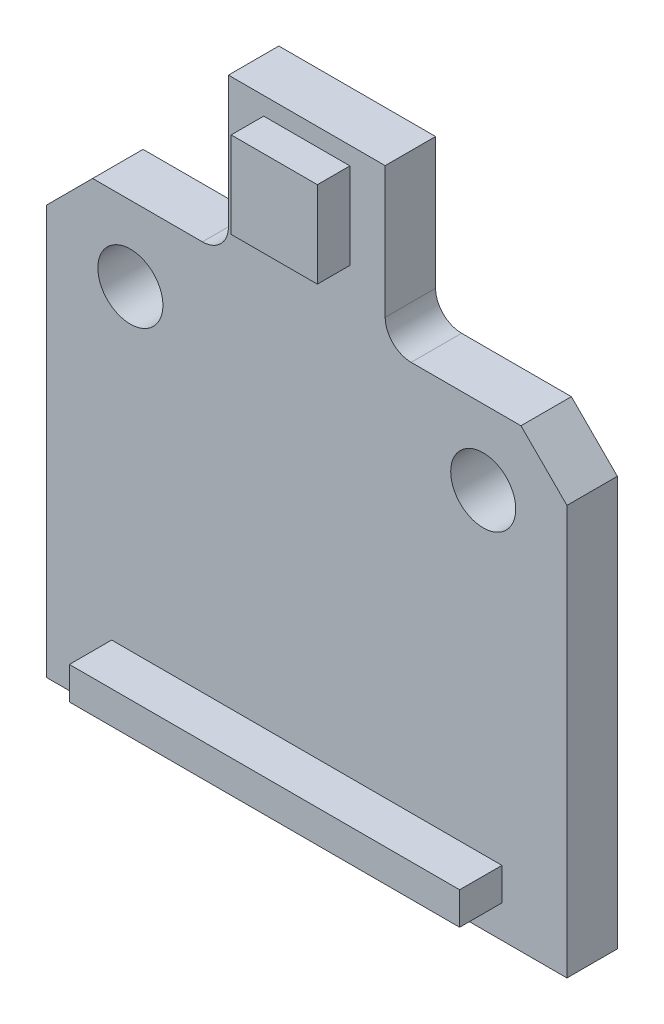
from build123d import *

# Parameters (mm, degrees)
SKETCH1_R           = 1
BOSS_EXTRUDE1_DEPTH = 1.55
SKETCH2_W           = 2.65
SKETCH2_H           = 2.65
BOSS_EXTRUDE2_DEPTH = 1
SKETCH3_W           = 12
SKETCH3_H           = 1
BOSS_EXTRUDE3_DEPTH = 1.3


with BuildPart() as part:
    # Sketch1 → Boss-Extrude1 (new body)
    with BuildSketch(Plane.XY):
        with BuildLine():
            Line((11.21, 14), (14.585786438, 14))
            Line((14.585786438, 14), (16, 12.585786438))
            Line((16, 12.585786438), (16, 0))
            Line((16, 0), (0, 0))
            Line((0, 0), (0, 12.585786438))
            Line((0, 12.585786438), (1.414213562, 14))
            Line((1.414213562, 14), (4.79, 14))
            ThreePointArc((4.79, 14), (5.355685425, 14.234314575), (5.59, 14.8))
            Line((5.59, 14.8), (5.59, 18.84))
            Line((5.59, 18.84), (10.41, 18.84))
            Line((10.41, 18.84), (10.41, 14.8))
            ThreePointArc((10.41, 14.8), (10.644314575, 14.234314575), (11.21, 14))
        make_face()
        with Locations(Location((2.575, 11.7, 0), (0, 0, 180))):
            Circle(SKETCH1_R, mode=Mode.SUBTRACT)
        with Locations(Location((13.425, 11.7, 0), (0, 0, 180))):
            Circle(SKETCH1_R, mode=Mode.SUBTRACT)
    extrude(amount=BOSS_EXTRUDE1_DEPTH)

    # Sketch2 → Boss-Extrude2 (add)
    with BuildSketch(Plane.XY.offset(1.55)):
        with Locations((8, 16.965)):
            Rectangle(SKETCH2_W, SKETCH2_H)
    extrude(amount=BOSS_EXTRUDE2_DEPTH)

    # Sketch3 → Boss-Extrude3 (add)
    with BuildSketch(Plane.XY.offset(1.55)):
        with Locations((8, 1.5)):
            Rectangle(SKETCH3_W, SKETCH3_H)
    extrude(amount=BOSS_EXTRUDE3_DEPTH)


solid = part.part
